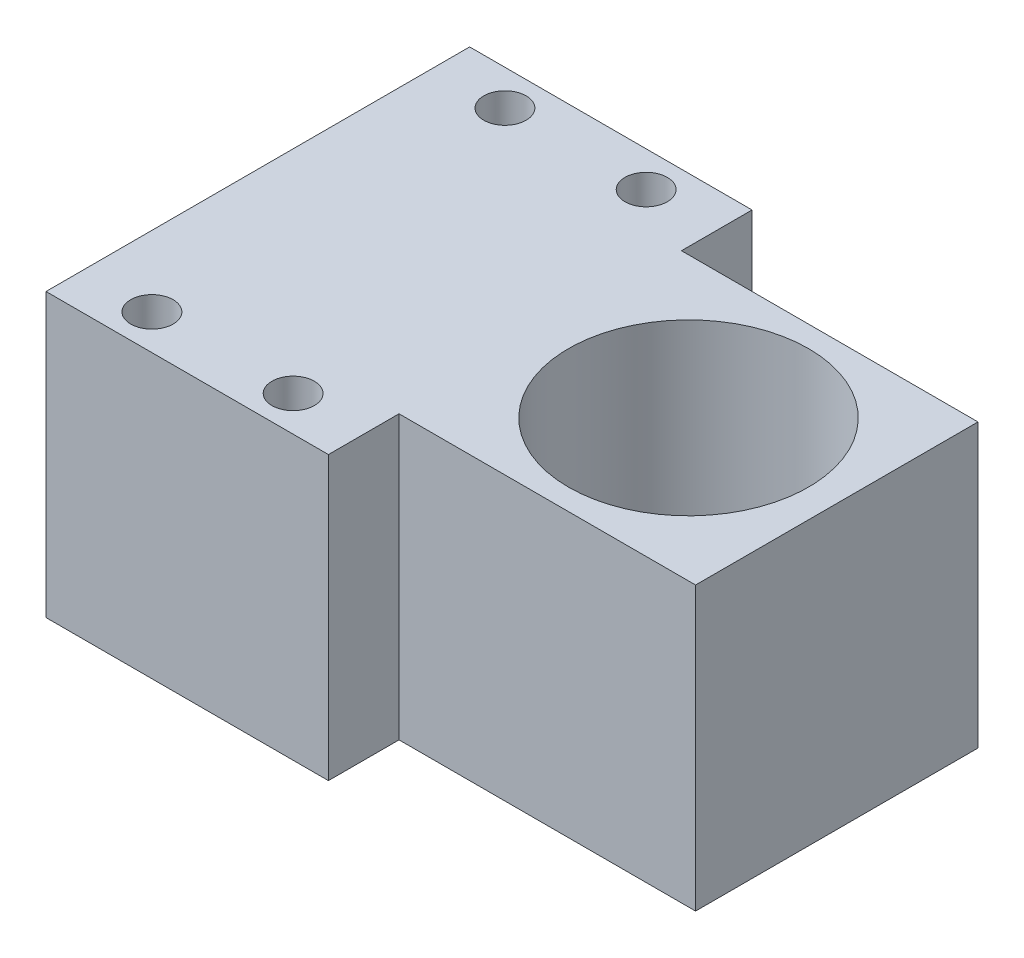
from build123d import *

# Parameters (mm, degrees)
SKETCH_1_W           = 20
SKETCH_1_H           = 20
SKETCH_1_R           = 7.5
EXTRUDE_1_DEPTH      = 10
EXTRUDE_2_DEPTH      = 0.0001
EXTRUDE_2_DEPTH_BACK = 10
SKETCH_2_W           = 5
SKETCH_2_H           = 2
SKETCH_3_R           = 1.5
CUT_EXTRUDE_1_DEPTH  = 27.925861175
SKETCH_4_R           = 1.5
CUT_EXTRUDE_2_DEPTH  = 27.925861175
SKETCH_5_W           = 20
SKETCH_5_H           = 20
EXTRUDE_3_DEPTH      = 21
SKETCH_6_R           = 8.5
CUT_EXTRUDE_3_DEPTH  = 40.824615503
SKETCH_7_W           = 10.0001
SKETCH_7_H           = 16
EXTRUDE_4_DEPTH      = 5
SKETCH_8_W           = 10.0001
SKETCH_8_H           = 17
EXTRUDE_5_DEPTH      = 5
SKETCH_9_R           = 1.5
CUT_EXTRUDE_4_DEPTH  = 40.824615503
SKETCH_10_W          = 30
SKETCH_10_H          = 20
EXTRUDE_6_DEPTH      = 10
SKETCH_11_R          = 7.5
CUT_EXTRUDE_5_DEPTH  = 10
SKETCH_12_R          = 1.5
CUT_EXTRUDE_6_DEPTH  = 20


with BuildPart() as part:
    # 草图1 → 凸台-拉伸1 (new body)
    with BuildSketch(Plane(origin=(0, 0, 0), x_dir=(0, 0, -1), z_dir=(1, 0, 0))):
        Rectangle(SKETCH_1_W, SKETCH_1_H)
        Circle(SKETCH_1_R, mode=Mode.SUBTRACT)
    extrude(amount=EXTRUDE_1_DEPTH)

    # 草图2 → 凸台-拉伸2 (add, two sides: drawn at the far end of the back side and taken through both)
    with BuildSketch(Plane(origin=(10, 0, 0), x_dir=(0, 0, -1), z_dir=(1, 0, 0)).offset(-EXTRUDE_2_DEPTH_BACK)):
        with Locations((-12.5, 9)):
            Rectangle(SKETCH_2_W, SKETCH_2_H)
        with Locations((12.5, 9)):
            Rectangle(SKETCH_2_W, SKETCH_2_H)
        with Locations((12.5, -9)):
            Rectangle(SKETCH_2_W, SKETCH_2_H)
        with Locations((-12.5, -9)):
            Rectangle(SKETCH_2_W, SKETCH_2_H)
    extrude(amount=EXTRUDE_2_DEPTH + EXTRUDE_2_DEPTH_BACK)

    # 草图3 → 切除-拉伸1 (cut, through all)
    with BuildSketch(Plane.XZ.offset(10)):
        with Locations(Location((5.00005, -12.5, 0), (0, 0, 270))):
            Circle(SKETCH_3_R)
    extrude(amount=-CUT_EXTRUDE_1_DEPTH, mode=Mode.SUBTRACT)

    # 草图4 → 切除-拉伸2 (cut, through all)
    with BuildSketch(Plane.XZ.offset(10)):
        with Locations(Location((5.00005, 12.5, 0), (0, 0, 270))):
            Circle(SKETCH_4_R)
    extrude(amount=-CUT_EXTRUDE_2_DEPTH, mode=Mode.SUBTRACT)

    # 草图5 → 凸台-拉伸3 (add)
    with BuildSketch(Plane(origin=(10, 0, 0), x_dir=(0, 0, -1), z_dir=(1, 0, 0))):
        Rectangle(SKETCH_5_W, SKETCH_5_H)
    extrude(amount=EXTRUDE_3_DEPTH)

    # 草图6 → 切除-拉伸3 (cut, through all)
    with BuildSketch(Plane(origin=(0, 10, 0), x_dir=(1, 0, 0), z_dir=(0, 1, 0))):
        with Locations(Location((20.50005, 0, 0), (0, 0, 270))):
            Circle(SKETCH_6_R)
    extrude(amount=-CUT_EXTRUDE_3_DEPTH, mode=Mode.SUBTRACT)

    # 草图7 → 凸台-拉伸4 (add)
    with BuildSketch(Plane(origin=(0, 0, -10), x_dir=(-1, 0, 0), z_dir=(0, 0, -1))):
        with Locations((-5.00005, 0)):
            Rectangle(SKETCH_7_W, SKETCH_7_H)
    extrude(amount=EXTRUDE_4_DEPTH)

    # 草图8 → 凸台-拉伸5 (add)
    with BuildSketch(Plane.XY.offset(10)):
        with Locations((5.00005, -0.5)):
            Rectangle(SKETCH_8_W, SKETCH_8_H)
    extrude(amount=EXTRUDE_5_DEPTH)

    # 草图9 → 切除-拉伸4 (cut, through all)
    with BuildSketch(Plane(origin=(0, 10, 0), x_dir=(1, 0, 0), z_dir=(0, 1, 0))):
        with Locations(Location((5.00005, -12.5, 0), (0, 0, 90))):
            Circle(SKETCH_9_R)
        with Locations(Location((5.00005, 12.5, 0), (0, 0, 90))):
            Circle(SKETCH_9_R)
    extrude(amount=-CUT_EXTRUDE_4_DEPTH, mode=Mode.SUBTRACT)

    # 草图10 → 凸台-拉伸6 (add)
    with BuildSketch(Plane.ZY):
        Rectangle(SKETCH_10_W, SKETCH_10_H)
    extrude(amount=EXTRUDE_6_DEPTH)

    # 草图11 → 切除-拉伸5 (cut)
    with BuildSketch(Plane.ZY.offset(10)):
        Circle(SKETCH_11_R)
    extrude(amount=-CUT_EXTRUDE_5_DEPTH, mode=Mode.SUBTRACT)

    # 草图12 → 切除-拉伸6 (cut)
    with BuildSketch(Plane.XZ.offset(10)):
        with Locations(Location((-4.99995, -12.5, 0), (0, 0, 270))):
            Circle(SKETCH_12_R)
        with Locations(Location((-4.99995, 12.5, 0), (0, 0, 270))):
            Circle(SKETCH_12_R)
    extrude(amount=-CUT_EXTRUDE_6_DEPTH, mode=Mode.SUBTRACT)


solid = part.part
